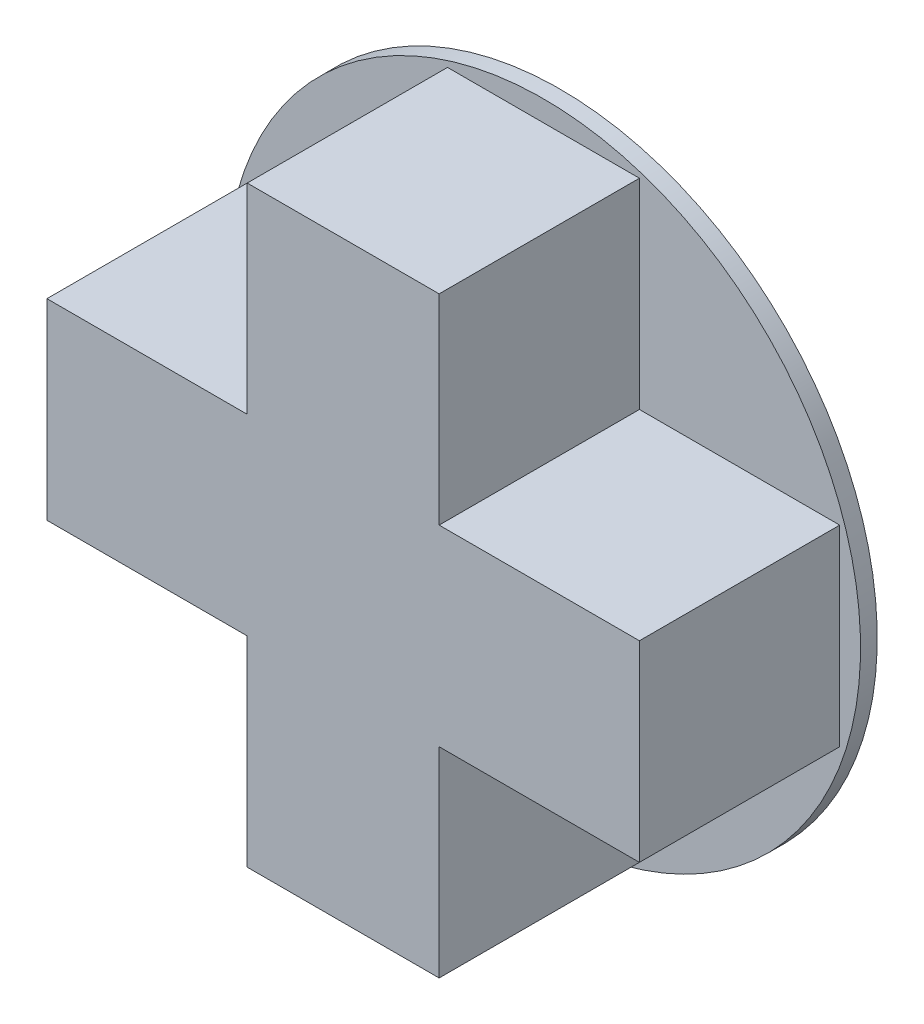
from build123d import *

# Parameters (mm, degrees)
BOSS_EXTRUDE1_DEPTH = 6
SKETCH2_R           = 9.5
BOSS_EXTRUDE2_DEPTH = 0.5
SKETCH4_R           = 1.75
CUT_EXTRUDE2_DEPTH  = 0.75


with BuildPart() as part:
    # Sketch1 → Boss-Extrude1 (new body)
    with BuildSketch(Plane.XY):
        Polygon((-2.875, 2.875), (-2.875, 8.875), (2.875, 8.875), (2.875, 2.875), (8.875, 2.875), (8.875, -2.875), (2.875, -2.875), (2.875, -8.875), (-2.875, -8.875), (-2.875, -2.875), (-8.875, -2.875), (-8.875, 2.875), align=None)
    extrude(amount=BOSS_EXTRUDE1_DEPTH)

    # Sketch2 → Boss-Extrude2 (add)
    with BuildSketch(Plane(origin=(0, 0, 0), x_dir=(-1, 0, 0), z_dir=(0, 0, -1))):
        Circle(SKETCH2_R)
    extrude(amount=BOSS_EXTRUDE2_DEPTH)

    # Sketch4 → Cut-Extrude2 (cut)
    with BuildSketch(Plane(origin=(0, 0, -0.5), x_dir=(-1, 0, 0), z_dir=(0, 0, -1))):
        with Locations((6, 0)):
            Circle(SKETCH4_R)
        with Locations((0, -6)):
            Circle(SKETCH4_R)
        with Locations((-6, 0)):
            Circle(SKETCH4_R)
        with Locations((0, 6)):
            Circle(SKETCH4_R)
    extrude(amount=-CUT_EXTRUDE2_DEPTH, mode=Mode.SUBTRACT)


solid = part.part
